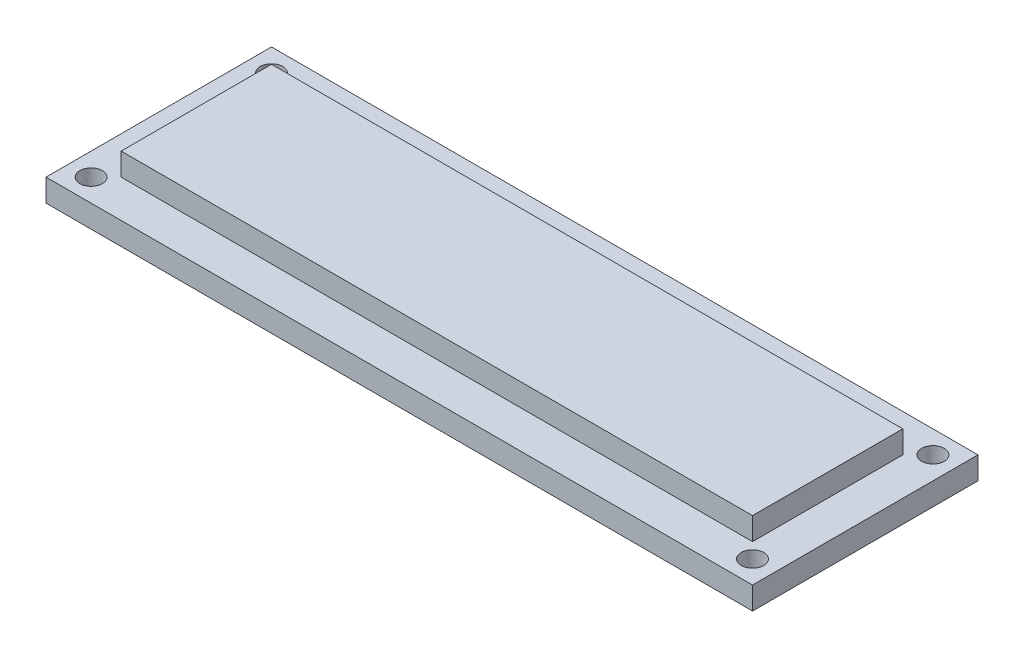
from build123d import *

# Parameters (mm, degrees)
SKETCH1_W           = 84
SKETCH1_H           = 20
BOSS_EXTRUDE1_DEPTH = 3
SKETCH2_W           = 94
SKETCH2_H           = 30
SKETCH2_R           = 1.5
BOSS_EXTRUDE2_DEPTH = 3


with BuildPart() as part:
    # Sketch1 → Boss-Extrude1 (new body)
    with BuildSketch(Plane(origin=(0, 0, 0), x_dir=(1, 0, 0), z_dir=(0, 1, 0))):
        Rectangle(SKETCH1_W, SKETCH1_H)
    extrude(amount=BOSS_EXTRUDE1_DEPTH)

    # Sketch2 → Boss-Extrude2 (add)
    with BuildSketch(Plane.XZ):
        Rectangle(SKETCH2_W, SKETCH2_H)
        with Locations(Location((-44, 12, 0), (0, 0, 270))):
            Circle(SKETCH2_R, mode=Mode.SUBTRACT)
        with Locations(Location((-44, -12, 0), (0, 0, 270))):
            Circle(SKETCH2_R, mode=Mode.SUBTRACT)
        with Locations(Location((44, 12, 0), (0, 0, 270))):
            Circle(SKETCH2_R, mode=Mode.SUBTRACT)
        with Locations(Location((44, -12, 0), (0, 0, 270))):
            Circle(SKETCH2_R, mode=Mode.SUBTRACT)
    extrude(amount=BOSS_EXTRUDE2_DEPTH)


solid = part.part
